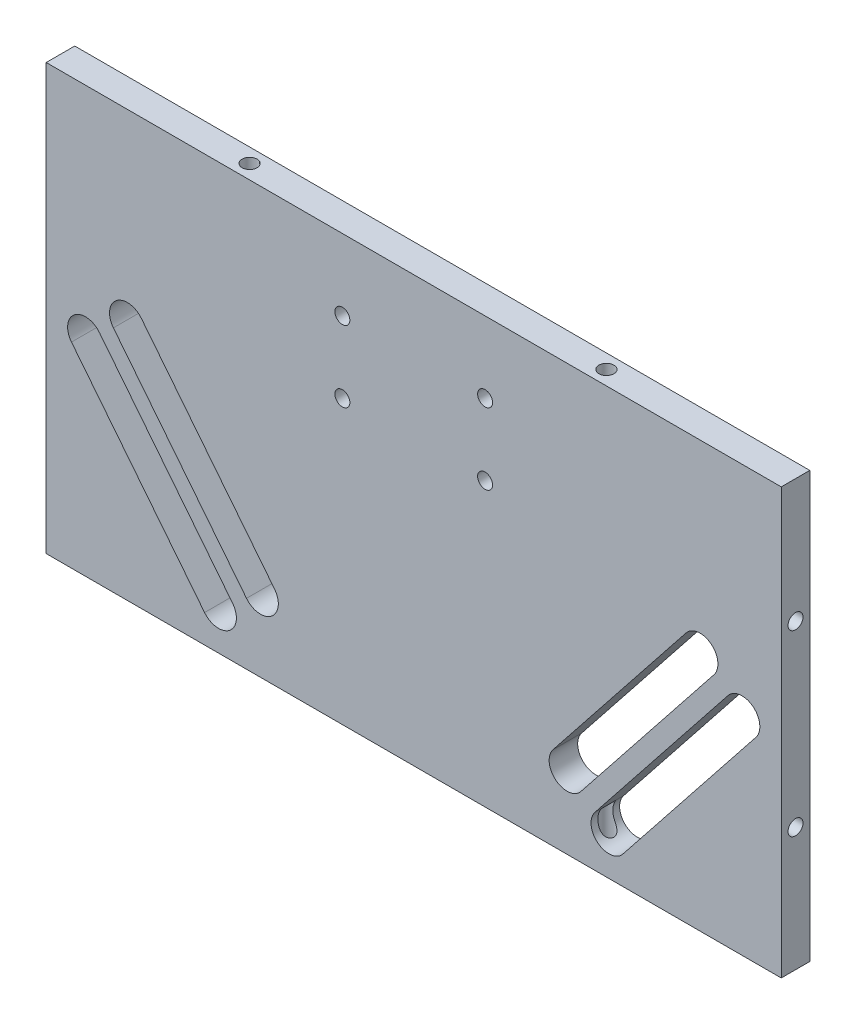
from build123d import *

# Parameters (mm, degrees)
SKETCH1_W           = 119.2019
SKETCH1_H           = 206
SKETCH1_R           = 2.1
BOSS_EXTRUDE1_DEPTH = 8
SKETCH2_R           = 2.1
CUT_EXTRUDE1_DEPTH  = 14
CUT_EXTRUDE2_START  = -105.2019
SKETCH2_2_R         = 2.1
CUT_EXTRUDE2_DEPTH  = 14
SKETCH3_R           = 2.1
CUT_EXTRUDE3_DEPTH  = 14
CUT_EXTRUDE4_START  = -192
SKETCH3_2_R         = 2.1
CUT_EXTRUDE4_DEPTH  = 14


with BuildPart() as part:
    # Sketch1 → Boss-Extrude1 (new body)
    with BuildSketch(Plane(origin=(0, 0, 0), x_dir=(0, 1, 0), z_dir=(0, 0, 1))):
        with Locations((59.60095, 103)):
            Rectangle(SKETCH1_W, SKETCH1_H)
        with Locations(Location((79.2019, 123, 0), (0, 0, 270))):
            Circle(SKETCH1_R, mode=Mode.SUBTRACT)
        with Locations(Location((99.2019, 123, 0), (0, 0, 270))):
            Circle(SKETCH1_R, mode=Mode.SUBTRACT)
        with Locations(Location((79.2019, 83, 0), (0, 0, 270))):
            Circle(SKETCH1_R, mode=Mode.SUBTRACT)
        with Locations(Location((99.2019, 83, 0), (0, 0, 270))):
            Circle(SKETCH1_R, mode=Mode.SUBTRACT)
        with BuildLine():
            Line((7.891459352, 161.613757243), (54.886399567, 198.916245018))
            ThreePointArc((54.886399567, 198.916245018), (61.911185233, 198.108540648), (61.103480863, 191.083754982))
            Line((61.103480863, 191.083754982), (14.108540648, 153.781267207))
            ThreePointArc((14.108540648, 153.781267207), (7.083754982, 154.588971577), (7.891459352, 161.613757243))
        make_face(mode=Mode.SUBTRACT)
        with BuildLine():
            Line((17.217081296, 149.865022189), (64.212021511, 187.167509964))
            ThreePointArc((64.212021511, 187.167509964), (71.236807177, 186.359805594), (70.429102807, 179.335019928))
            Line((70.429102807, 179.335019928), (23.434162592, 142.032532154))
            ThreePointArc((23.434162592, 142.032532154), (16.409376926, 142.840236524), (17.217081296, 149.865022189))
        make_face(mode=Mode.SUBTRACT)
        with BuildLine():
            Line((23.434162592, 63.967467846), (70.429102807, 26.664980072))
            ThreePointArc((70.429102807, 26.664980072), (71.236807177, 19.640194406), (64.212021511, 18.832490036))
            Line((64.212021511, 18.832490036), (17.217081296, 56.134977811))
            ThreePointArc((17.217081296, 56.134977811), (16.409376926, 63.159763476), (23.434162592, 63.967467846))
        make_face(mode=Mode.SUBTRACT)
        with BuildLine():
            Line((14.108540648, 52.218732793), (61.103480863, 14.916245018))
            ThreePointArc((61.103480863, 14.916245018), (61.911185233, 7.891459352), (54.886399567, 7.083754982))
            Line((54.886399567, 7.083754982), (7.891459352, 44.386242757))
            ThreePointArc((7.891459352, 44.386242757), (7.083754982, 51.411028423), (14.108540648, 52.218732793))
        make_face(mode=Mode.SUBTRACT)
    extrude(amount=BOSS_EXTRUDE1_DEPTH)

    # Sketch2 → Cut-Extrude1 (cut)
    with BuildSketch(Plane.XZ):
        with Locations(Location((-153, 4, 0), (0, 0, 270))):
            Circle(SKETCH2_R)
        with Locations(Location((-53, 4, 0), (0, 0, 270))):
            Circle(SKETCH2_R)
    extrude(amount=-CUT_EXTRUDE1_DEPTH, mode=Mode.SUBTRACT)

    # Sketch2<2> → Cut-Extrude2 (cut)
    with BuildSketch(Plane.XZ.offset(CUT_EXTRUDE2_START)):
        with Locations(Location((-153, 4, 0), (0, 0, 270))):
            Circle(SKETCH2_2_R)
        with Locations(Location((-53, 4, 0), (0, 0, 270))):
            Circle(SKETCH2_2_R)
    extrude(amount=-CUT_EXTRUDE2_DEPTH, mode=Mode.SUBTRACT)

    # Sketch3 → Cut-Extrude3 (cut)
    with BuildSketch(Plane.YZ):
        with Locations(Location((34.60095, 4, 0), (0, 0, 270))):
            Circle(SKETCH3_R)
        with Locations(Location((84.60095, 4, 0), (0, 0, 270))):
            Circle(SKETCH3_R)
    extrude(amount=-CUT_EXTRUDE3_DEPTH, mode=Mode.SUBTRACT)

    # Sketch3<2> → Cut-Extrude4 (cut)
    with BuildSketch(Plane.YZ.offset(CUT_EXTRUDE4_START)):
        with Locations(Location((34.60095, 4, 0), (0, 0, 270))):
            Circle(SKETCH3_2_R)
        with Locations(Location((84.60095, 4, 0), (0, 0, 270))):
            Circle(SKETCH3_2_R)
    extrude(amount=-CUT_EXTRUDE4_DEPTH, mode=Mode.SUBTRACT)


solid = part.part
